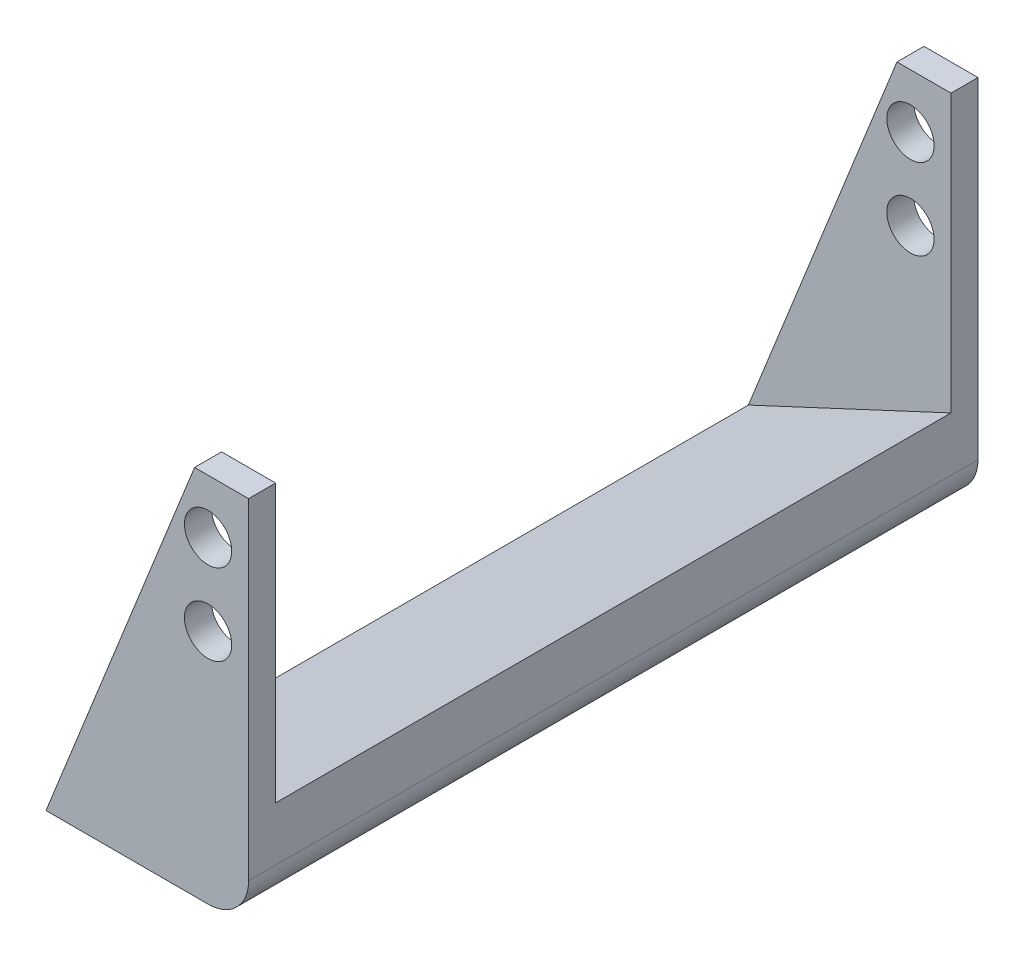
from build123d import *

# Parameters (mm, degrees)
BOSS_EXTRUDE1_DEPTH = 25
SKETCH2_R           = 1.75
BOSS_EXTRUDE2_DEPTH = 2
FILLET1_R           = 3


with BuildPart() as part:
    # Sketch1 → Boss-Extrude1 (new, symmetric)
    with BuildSketch(Plane.XY):
        Polygon((0, 0), (15, 0), (15, 6.994614872), align=None)
    extrude(amount=BOSS_EXTRUDE1_DEPTH, both=True)

    # Sketch2 → Boss-Extrude2 (add)
    with BuildSketch(Plane.XY.offset(25)):
        Polygon((15, 0), (15, 27.5), (11, 27.5), (0, 0), align=None)
        with Locations((12, 23.5)):
            Circle(SKETCH2_R, mode=Mode.SUBTRACT)
        with Locations((12, 17.5)):
            Circle(SKETCH2_R, mode=Mode.SUBTRACT)
    boss_extrude2 = extrude(amount=BOSS_EXTRUDE2_DEPTH)

    # Mirror1: Boss-Extrude2 across plane
    add(boss_extrude2.mirror(Plane.XY))

    # Fillet1
    fillet1_edges = [part.edges().sort_by_distance(p)[0] for p in [
        (15, 0, 0),
    ]]
    fillet(fillet1_edges, radius=FILLET1_R)


solid = part.part
